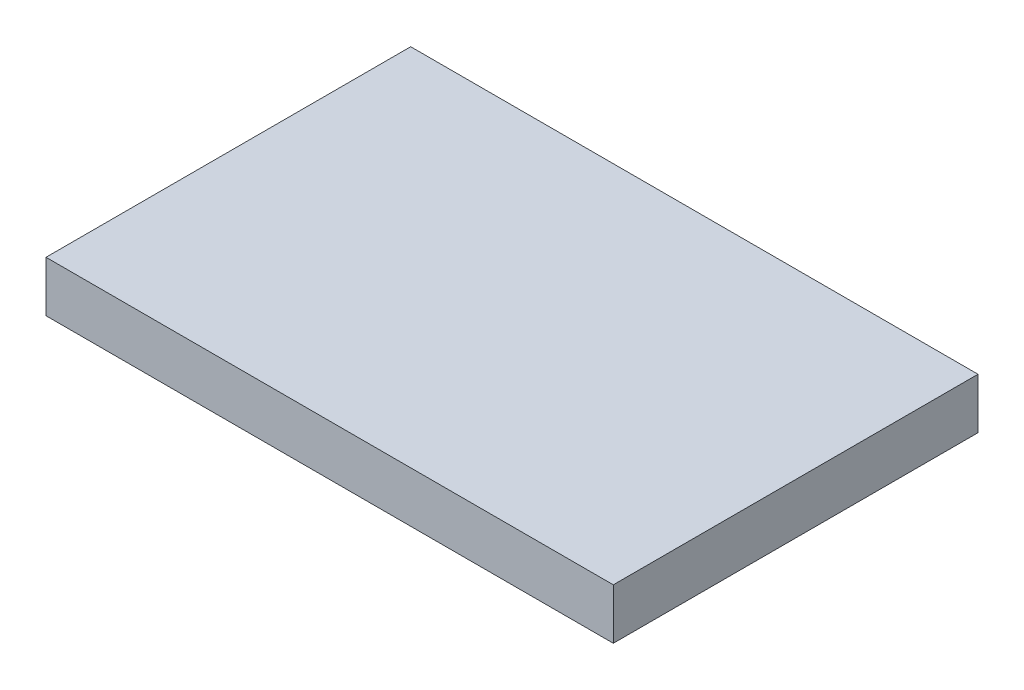
from build123d import *

# Parameters (mm, degrees)
SKETCH1_W           = 28
SKETCH1_H           = 18
BOSS_EXTRUDE1_DEPTH = 2.5


with BuildPart() as part:
    # Sketch1 → Boss-Extrude1 (new body)
    with BuildSketch(Plane(origin=(0, 0, 0), x_dir=(1, 0, 0), z_dir=(0, 1, 0))):
        with Locations((14, 9)):
            Rectangle(SKETCH1_W, SKETCH1_H)
    extrude(amount=BOSS_EXTRUDE1_DEPTH)


solid = part.part
